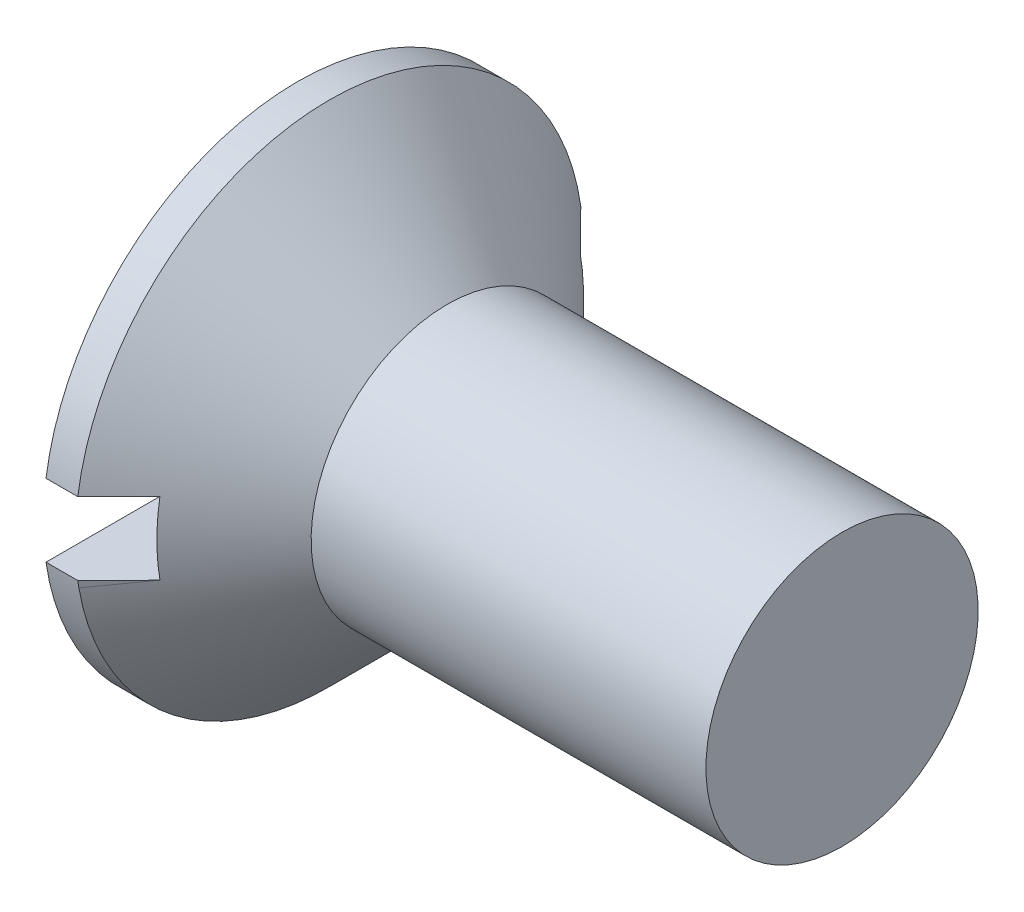
from build123d import *

# Parameters (mm, degrees)
SKETCH2_W          = 5.6
SKETCH2_H          = 0.8
CUT_EXTRUDE1_DEPTH = 0.8


with BuildPart() as part:
    # Sketch1 → Revolve1 (revolve)
    with BuildSketch(Plane.XY):
        Polygon((0, 0), (0, 2.8), (0.35, 2.8), (1.65, 1.5), (6, 1.5), (6, 0), align=None)
    revolve(axis=Axis((6, 0, 0), (-1, 0, 0)))

    # Sketch2 → Cut-Extrude1 (cut)
    with BuildSketch(Plane.ZY):
        Rectangle(SKETCH2_W, SKETCH2_H)
    extrude(amount=-CUT_EXTRUDE1_DEPTH, mode=Mode.SUBTRACT)


solid = part.part
